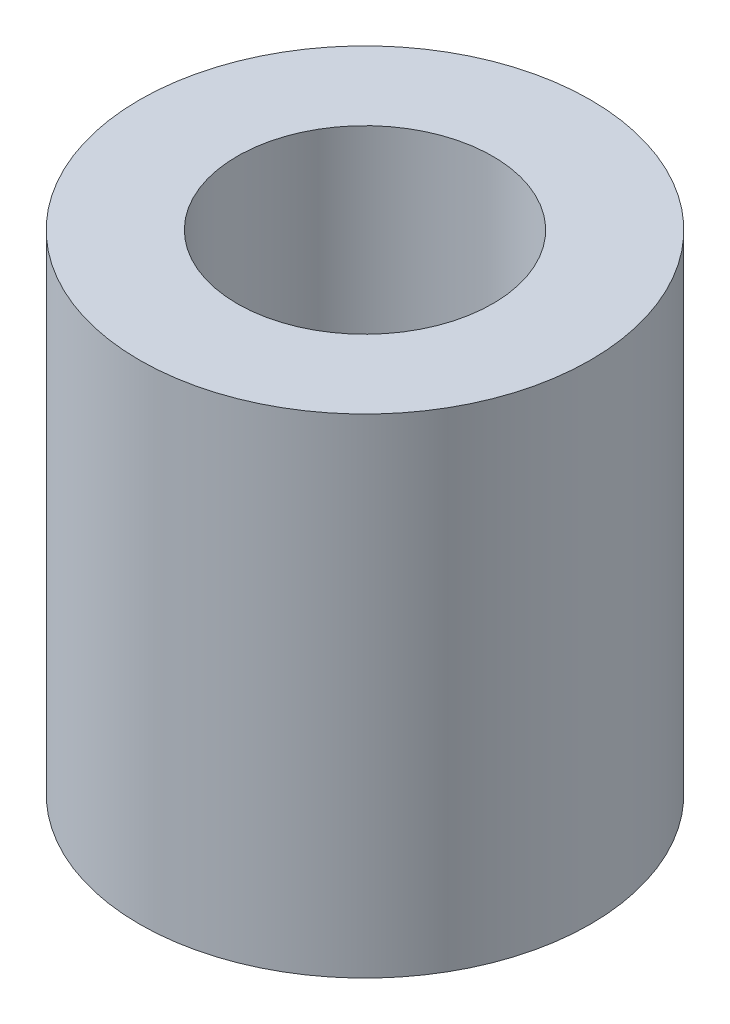
from build123d import *

# Parameters (mm, degrees)
SKETCH1_R            = 3
BOSS_EXTRUDE1_DEPTH  = 3.25
M3_CLEARANCE_HOLE1_D = 3.4


with BuildPart() as part:
    # Sketch1 → Boss-Extrude1 (new, symmetric)
    with BuildSketch(Plane(origin=(0, 0, 0), x_dir=(1, 0, 0), z_dir=(0, 1, 0))):
        with Locations(Location((0, 0, 0), (0, 0, 90))):
            Circle(SKETCH1_R)
    extrude(amount=BOSS_EXTRUDE1_DEPTH, both=True)

    # M3 Clearance Hole1 (through all)
    with Locations(Plane(origin=(0, 3.25, 0), x_dir=(1, 0, 0), z_dir=(0, 1, 0))):
        with Locations((0, 0)):
            Hole(M3_CLEARANCE_HOLE1_D / 2)


solid = part.part
